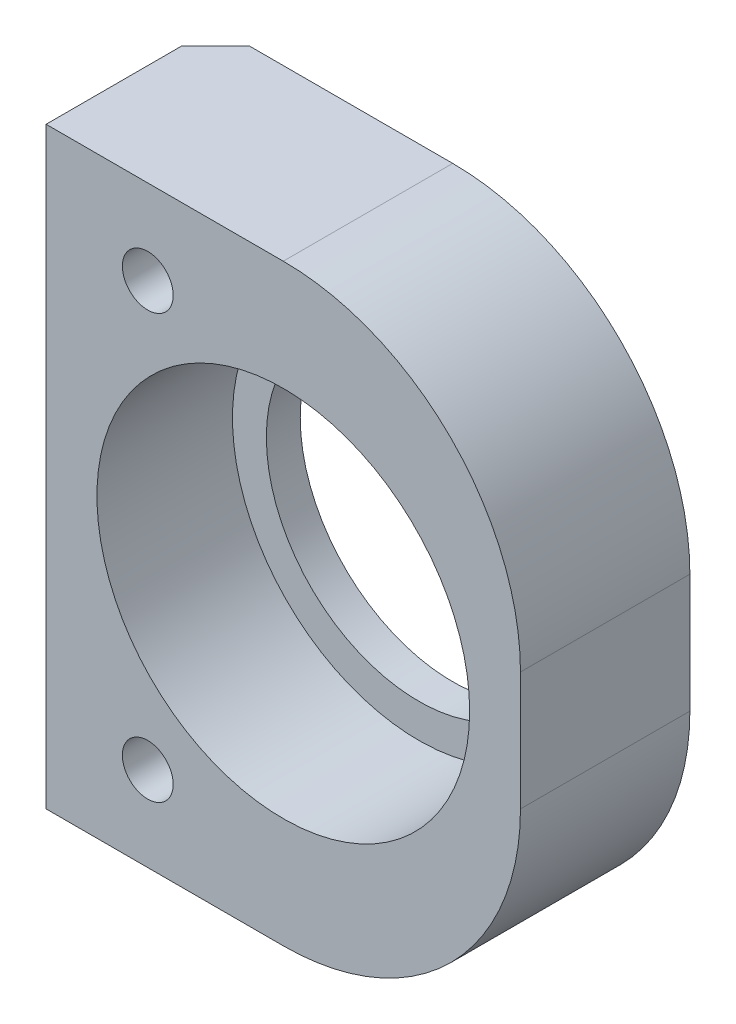
from build123d import *

# Parameters (mm, degrees)
CROQUIS1_W              = 35
CROQUIS1_H              = 28
CROQUIS1_R              = 11
CROQUIS1_R_2            = 1.5
SALIENTE_EXTRUIR1_DEPTH = 10
CROQUIS2_R              = 11
CROQUIS2_R_2            = 9
SALIENTE_EXTRUIR2_DEPTH = 2
REDONDEO1_R             = 14
CHAFL_N1_SIZE           = 2


with BuildPart() as part:
    # Croquis1 → Saliente-Extruir1 (new body)
    with BuildSketch(Plane(origin=(0, 0, 0), x_dir=(0, 1, 0), z_dir=(0, 0, 1))):
        Rectangle(CROQUIS1_W, CROQUIS1_H)
        with Locations(Location((0, 0, 0), (0, 0, 270))):
            Circle(CROQUIS1_R, mode=Mode.SUBTRACT)
        with Locations(Location((-12.5, 8, 0), (0, 0, 270))):
            Circle(CROQUIS1_R_2, mode=Mode.SUBTRACT)
        with Locations(Location((12.5, 8, 0), (0, 0, 90))):
            Circle(CROQUIS1_R_2, mode=Mode.SUBTRACT)
    extrude(amount=SALIENTE_EXTRUIR1_DEPTH)

    # Croquis2 → Saliente-Extruir2 (add)
    with BuildSketch(Plane(origin=(0, 0, 0), x_dir=(0, 1, 0), z_dir=(0, 0, 1))):
        with Locations(Location((0, 0, 0), (0, 0, 270))):
            Circle(CROQUIS2_R)
        with Locations(Location((0, 0, 0), (0, 0, 270))):
            Circle(CROQUIS2_R_2, mode=Mode.SUBTRACT)
    extrude(amount=SALIENTE_EXTRUIR2_DEPTH)

    # Redondeo1
    redondeo1_edges = [part.edges().sort_by_distance(p)[0] for p in [
        (14, 17.5, 5),
        (14, -17.5, 5),
    ]]
    fillet(redondeo1_edges, radius=REDONDEO1_R)

    # Chaflán1
    chafl_n1_edges = [part.edges().sort_by_distance(p)[0] for p in [
        (-14, 0, 0),
    ]]
    chamfer(chafl_n1_edges, length=CHAFL_N1_SIZE)


solid = part.part
